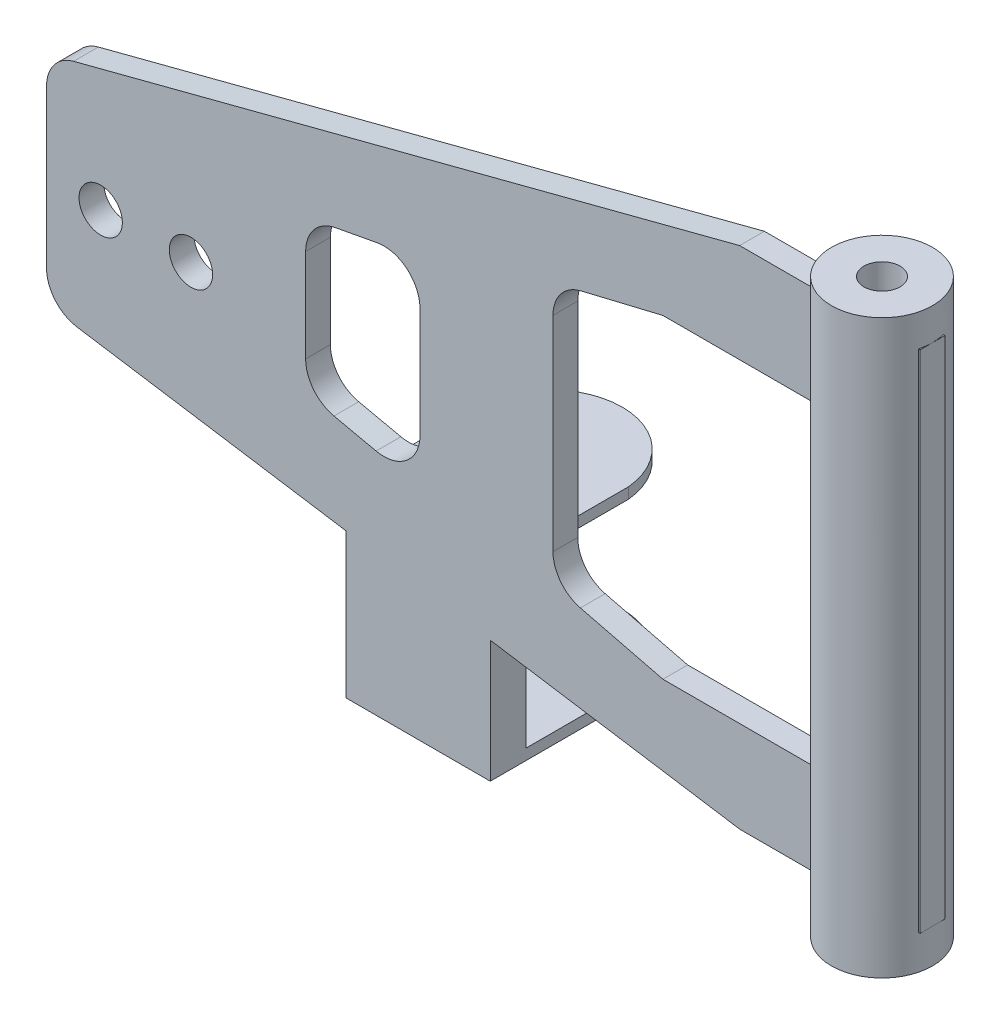
from build123d import *

# Parameters (mm, degrees)
EXTRUDE_1_DEPTH          = 6.86
SKETCH_3_R               = 14
EXTRUDE_2_DEPTH          = 140
SKETCH_4_R               = 14
EXTRUDE_3_DEPTH          = 9.54
EXTRUDE_START            = 8.87
SKETCH_5_R               = 14
EXTRUDE_4_DEPTH          = 8.87
SKETCH_6_W               = 40
SKETCH_6_H               = 51.5
EXTRUDE_5_DEPTH          = 50
CUT_EXTRUDE_1_DEPTH      = 70
SKETCH_8_W               = 58.379913489
SKETCH_8_H               = 45.5
CUT_EXTRUDE_2_DEPTH      = 50
SKETCH_9_R               = 5
CUT_EXTRUDE_3_DEPTH      = 60
EXTRUDE_6_DEPTH          = 6.86
SKETCH_11_R              = 6
CUT_EXTRUDE_4_DEPTH      = 6.86
CUT_EXTRUDE_5_DEPTH      = 218.354242016
CUT_EXTRUDE_5_DEPTH_BACK = 218.354242016
SKETCH_12_R              = 5
CUT_EXTRUDE_6_DEPTH      = 6.86
CUT_EXTRUDE_7_DEPTH      = 6.86
FILLET_1_R               = 10
FILLET_2_R               = 10


with BuildPart() as part:
    # 스케치1 → 보스-돌출1 (new body)
    with BuildSketch(Plane.XY):
        Polygon((-140.292347602, 27.740456746), (-140.292347602, -32.259543254), (51.707652398, -62.259543254), (101.707652398, -62.259543254), (101.707652398, 77.740456746), (51.707652398, 77.740456746), align=None)
    extrude(amount=EXTRUDE_1_DEPTH)

    # 스케치3 → 보스-돌출2 (add)
    with BuildSketch(Plane(origin=(0, 77.740456746, 0), x_dir=(1, 0, 0), z_dir=(0, 1, 0))):
        with Locations((87.707652398, -3.43)):
            Circle(SKETCH_3_R)
    extrude(amount=-EXTRUDE_2_DEPTH)

    # 스케치4 → 보스-돌출3 (add)
    with BuildSketch(Plane.XZ.offset(62.259543254)):
        with Locations((87.707652398, 3.43)):
            Circle(SKETCH_4_R)
    extrude(amount=EXTRUDE_3_DEPTH)

    # 스케치5 → 보스-돌출4 (add)
    with BuildSketch(Plane(origin=(0, 77.740456746, 0), x_dir=(1, 0, 0), z_dir=(0, 1, 0)).offset(EXTRUDE_START)):
        with Locations(Location((87.707652398, -3.43, 0), (0, 0, 270))):
            Circle(SKETCH_5_R)
    extrude(amount=-EXTRUDE_4_DEPTH)

    # 스케치6 → 보스-돌출5 (add)
    with BuildSketch(Plane(origin=(0, 0, 0), x_dir=(-1, 0, 0), z_dir=(0, 0, -1))):
        with Locations((37.365670703, -59.549543254)):
            Rectangle(SKETCH_6_W, SKETCH_6_H)
    extrude(amount=EXTRUDE_5_DEPTH)

    # 스케치7 → 컷-돌출1 (cut)
    with BuildSketch(Plane.XZ.offset(85.299543254)):
        with BuildLine():
            Line((-57.365670703, -31.410504054), (-57.365670703, -50))
            Line((-57.365670703, -50), (-17.365670703, -50))
            Line((-17.365670703, -50), (-17.365670703, -31.410504054))
            ThreePointArc((-17.365670703, -31.410504054), (-37.365670703, -49.67087302), (-57.365670703, -31.410504054))
        make_face()
    extrude(amount=-CUT_EXTRUDE_1_DEPTH, mode=Mode.SUBTRACT)

    # 스케치8 → 컷-돌출2 (cut)
    with BuildSketch(Plane(origin=(-17.365670703, 0, 0), x_dir=(0, 0, -1), z_dir=(1, 0, 0))):
        with Locations((32.189956745, -59.549543254)):
            Rectangle(SKETCH_8_W, SKETCH_8_H)
    extrude(amount=-CUT_EXTRUDE_2_DEPTH, mode=Mode.SUBTRACT)

    # 스케치9 → 컷-돌출3 (cut)
    with BuildSketch(Plane.XZ.offset(85.299543254)):
        with Locations((-37.365670703, -29.58800733)):
            Circle(SKETCH_9_R)
    extrude(amount=-CUT_EXTRUDE_3_DEPTH, mode=Mode.SUBTRACT)

    # 스케치10 → 보스-돌출6 (add)
    with BuildSketch(Plane.XY):
        Polygon((-17.365670703, -51.466836519), (-17.365670703, -85.299543254), (-57.365670703, -85.299543254), (-57.365670703, -45.216836519), align=None)
    extrude(amount=EXTRUDE_6_DEPTH)

    # 스케치11 → 컷-돌출4 (cut)
    with BuildSketch(Plane(origin=(0, 0, 0), x_dir=(-1, 0, 0), z_dir=(0, 0, -1))):
        with Locations((100.292347602, -2.259543254)):
            Circle(SKETCH_11_R)
        with Locations((125.292347602, -2.259543254)):
            Circle(SKETCH_11_R)
    extrude(amount=-CUT_EXTRUDE_4_DEPTH, mode=Mode.SUBTRACT)

    # 스케치12 → 컷-돌출5 (cut, two sides: drawn at the far end of the back side and taken through both)
    with BuildSketch(Plane.XZ.offset(71.799543254).offset(-CUT_EXTRUDE_5_DEPTH_BACK)):
        with Locations((87.707652398, 3.43)):
            Circle(SKETCH_12_R)
    extrude(amount=CUT_EXTRUDE_5_DEPTH + CUT_EXTRUDE_5_DEPTH_BACK, mode=Mode.SUBTRACT)

    # 스케치13 → 컷-돌출6 (cut)
    with BuildSketch(Plane(origin=(0, 0, 0), x_dir=(-1, 0, 0), z_dir=(0, 0, -1))):
        Polygon((-74.134329297, 50.339076342), (-30.453327594, 50.339076342), (0, 43.027707352), (0, -29.365200476), (-30.453327594, -36.922211026), (-74.134329297, -36.922211026), align=None)
    extrude(amount=-CUT_EXTRUDE_6_DEPTH, mode=Mode.SUBTRACT)

    # 스케치14 → 컷-돌출7 (cut)
    with BuildSketch(Plane(origin=(0, 0, 0), x_dir=(-1, 0, 0), z_dir=(0, 0, -1))):
        Polygon((68.524633072, 24.49831751), (36.848219376, 30.426812619), (36.848219376, -24.572302869), (68.524633072, -17.60850751), align=None)
    extrude(amount=-CUT_EXTRUDE_7_DEPTH, mode=Mode.SUBTRACT)

    # 필렛1
    fillet_1_edges = [part.edges().sort_by_distance(p)[0] for p in [
        (0, 43.027707352, 3.43),
        (0, -29.365200476, 3.43),
        (-68.524633072, 24.49831751, 3.43),
        (-68.524633072, -17.60850751, 3.43),
        (-36.848219376, -24.572302869, 3.43),
        (-36.848219376, 30.426812619, 3.43),
    ]]
    fillet(fillet_1_edges, radius=FILLET_1_R)

    # 필렛2
    fillet_2_edges = [part.edges().sort_by_distance(p)[0] for p in [
        (-140.292347602, -32.259543254, 3.43),
        (-140.292347602, 27.740456746, 3.43),
    ]]
    fillet(fillet_2_edges, radius=FILLET_2_R)


solid = part.part
